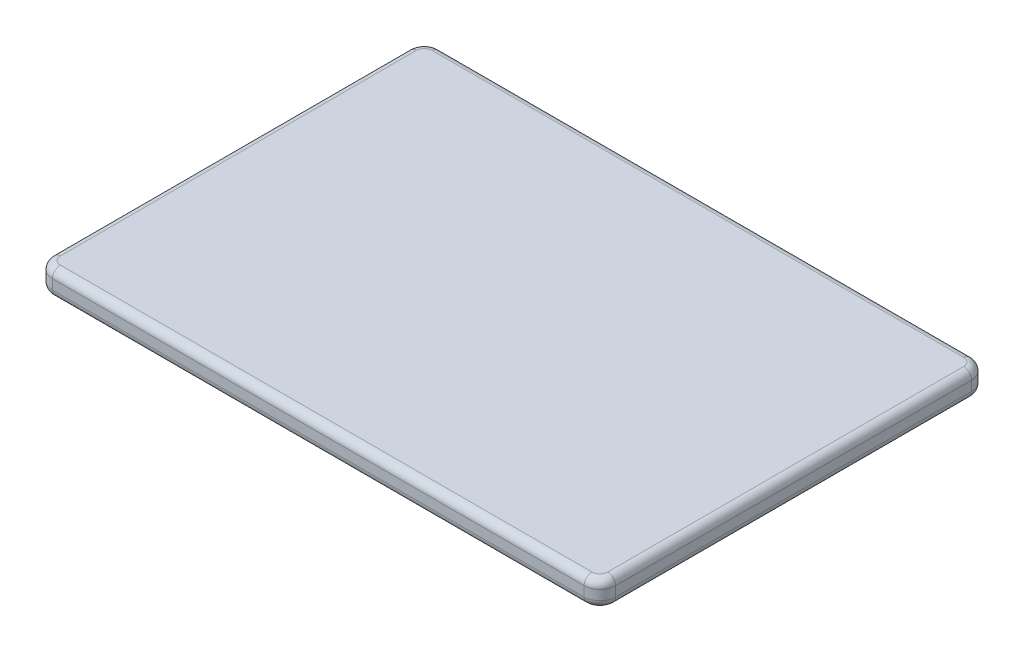
from build123d import *

# Parameters (mm, degrees)
SKETCH1_W           = 358.14
SKETCH1_H           = 246.38
BOSS_EXTRUDE1_DEPTH = 16.256
FILLET1_R           = 10
FILLET2_R           = 5
FILLET3_R           = 5


with BuildPart() as part:
    # Sketch1 → Boss-Extrude1 (new body)
    with BuildSketch(Plane(origin=(0, 0, 0), x_dir=(1, 0, 0), z_dir=(0, 1, 0))):
        with Locations((1000.018849058, 721.529961316)):
            Rectangle(SKETCH1_W, SKETCH1_H)
    extrude(amount=BOSS_EXTRUDE1_DEPTH)

    # Fillet1
    fillet1_edges = [part.edges().sort_by_distance(p)[0] for p in [
        (1179.088849058, 8.128, -598.339961316),
        (820.948849058, 8.128, -598.339961316),
        (820.948849058, 8.128, -844.719961316),
        (1179.088849058, 8.128, -844.719961316),
    ]]
    fillet(fillet1_edges, radius=FILLET1_R)

    # Fillet2
    fillet2_edges = [part.edges().sort_by_distance(p)[0] for p in [
        (1179.088849058, 16.256, -721.529961316),
        (1000.018849058, 16.256, -598.339961316),
        (1000.018849058, 16.256, -844.719961316),
        (820.948849058, 16.256, -721.529961316),
        (1176.15991687, 16.256, -841.791029128),
        (823.877781246, 16.256, -841.791029128),
        (823.877781246, 16.256, -601.268893504),
        (1176.15991687, 16.256, -601.268893504),
    ]]
    fillet(fillet2_edges, radius=FILLET2_R)

    # Fillet3
    fillet3_edges = [part.edges().sort_by_distance(p)[0] for p in [
        (1179.088849058, 0, -721.529961316),
        (1000.018849058, 0, -598.339961316),
        (820.948849058, 0, -721.529961316),
        (1000.018849058, 0, -844.719961316),
        (1176.15991687, 0, -841.791029128),
        (823.877781246, 0, -841.791029128),
        (823.877781246, 0, -601.268893504),
        (1176.15991687, 0, -601.268893504),
    ]]
    fillet(fillet3_edges, radius=FILLET3_R)


solid = part.part
